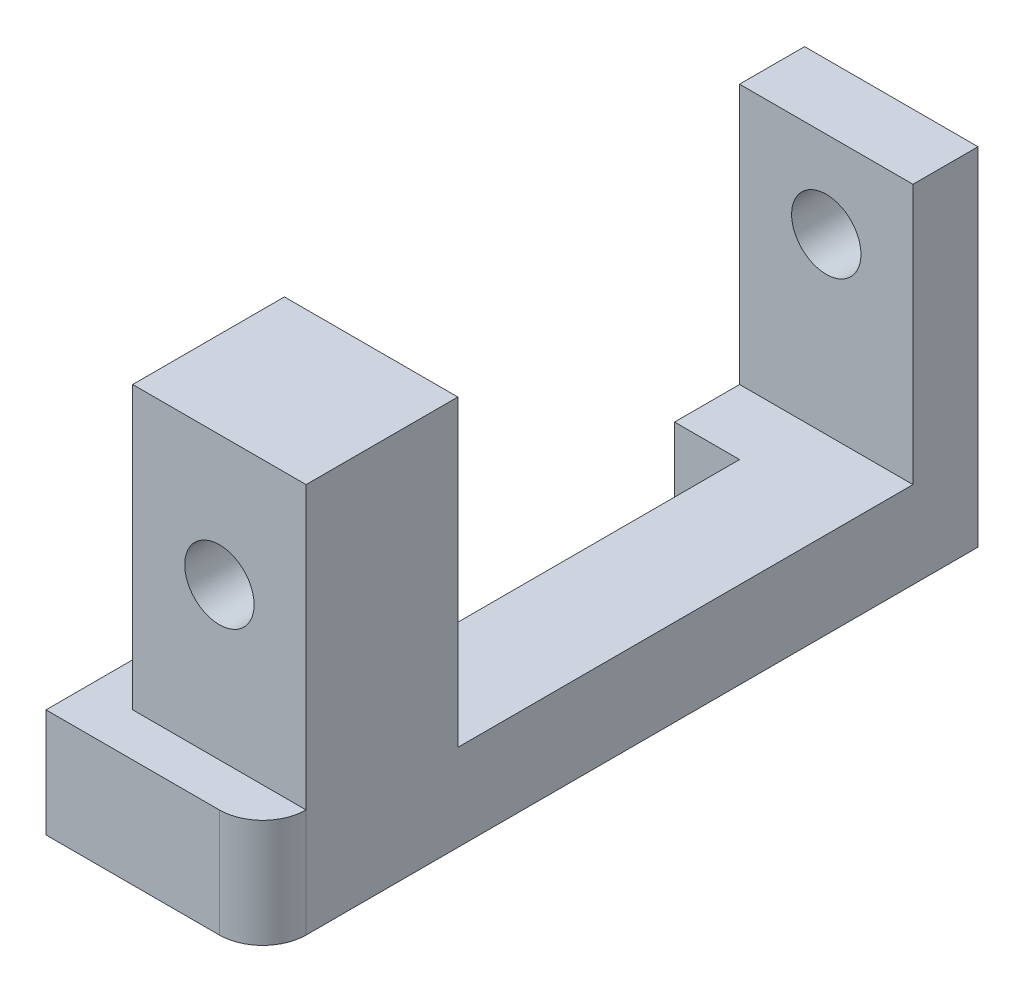
from build123d import *

# Parameters (mm, degrees)
BOSS_EXTRUDE1_DEPTH = 8
CUT_EXTRUDE2_DEPTH  = 21
BOSS_EXTRUDE2_DEPTH = 3
BOSS_EXTRUDE5_DEPTH = 5
SKETCH6_R           = 1.6
CUT_EXTRUDE3_DEPTH  = 38.215588132


with BuildPart() as part:
    # Sketch1 → Boss-Extrude1 (new body)
    with BuildSketch(Plane(origin=(0, 0, 0), x_dir=(0, 0, -1), z_dir=(1, 0, 0))):
        Polygon((0, 0), (0, 16), (-3, 16), (-3, 4), (-24, 4), (-24, 18), (-31, 18), (-31, 0), align=None)
    extrude(amount=-BOSS_EXTRUDE1_DEPTH)

    # Sketch5 → Cut-Extrude2 (cut)
    with BuildSketch(Plane.XY.offset(3)):
        Polygon((-8, 0), (-3, 0), (-5, 4), (-8, 4), align=None)
    extrude(amount=CUT_EXTRUDE2_DEPTH, mode=Mode.SUBTRACT)

    # Sketch8 → Boss-Extrude2 (add)
    with BuildSketch(Plane.XY.offset(3)):
        Polygon((-8, 4), (-5, 4), (-3, 0), (-8, 0), align=None)
    extrude(amount=BOSS_EXTRUDE2_DEPTH)

    # Sketch11 → Boss-Extrude5 (add)
    with BuildSketch(Plane.XZ):
        with BuildLine():
            Line((-10, 26), (-10, 33))
            Line((-10, 33), (-2, 33))
            ThreePointArc((-2, 33), (-0.585786438, 32.414213562), (0, 31))
            Line((0, 31), (-8, 31))
            Line((-8, 31), (-8, 24))
            ThreePointArc((-8, 24), (-9.414213562, 24.585786438), (-10, 26))
        make_face()
    extrude(amount=-BOSS_EXTRUDE5_DEPTH)

    # Sketch6 → Cut-Extrude3 (cut, through all)
    with BuildSketch(Plane.XY.offset(31)):
        with Locations((-4, 12)):
            Circle(SKETCH6_R)
    extrude(amount=-CUT_EXTRUDE3_DEPTH, mode=Mode.SUBTRACT)


solid = part.part
